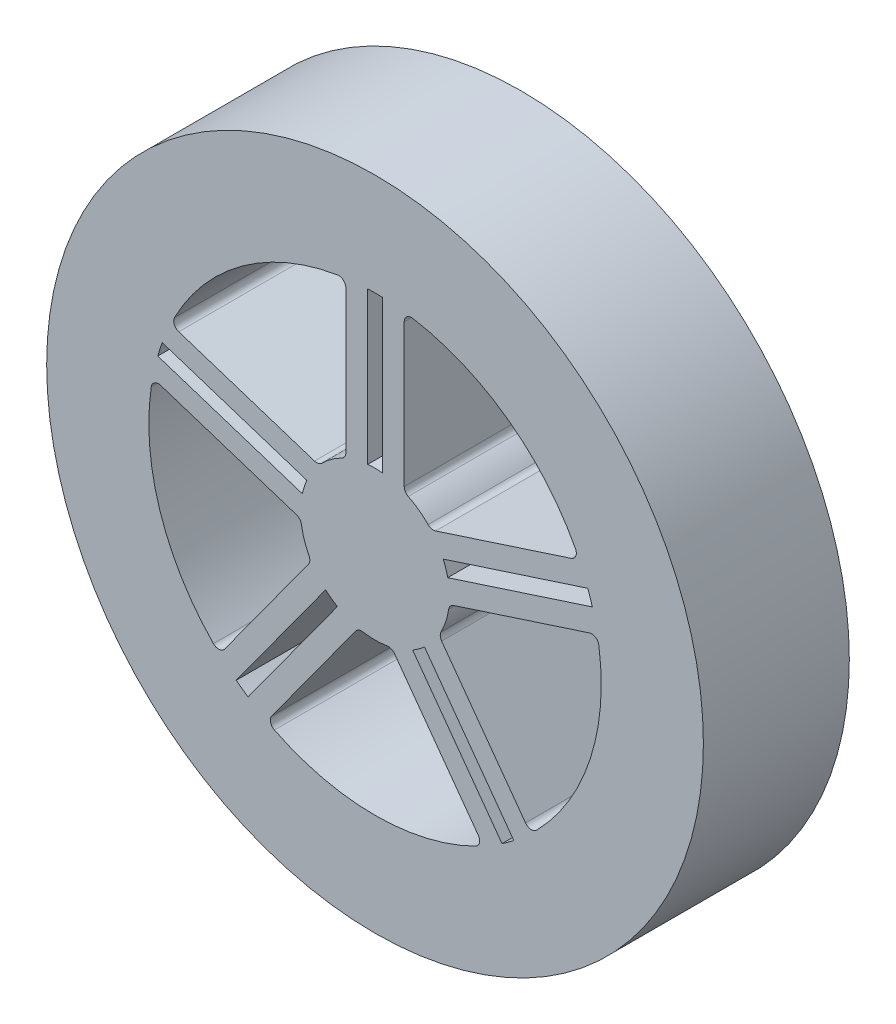
from build123d import *

# Parameters (mm, degrees)
ESQUISSE1_R                  = 5.1
ESQUISSE1_R_2                = 2.1
BOSS_EXTRU_1_DEPTH           = 10
ESQUISSE2_R                  = 22.5
BOSS_EXTRU_3_DEPTH           = 10
CONG_5_R                     = 0.5
R_P_TITION_CIRCULAIRE2_COUNT = 5
CONG_6_R                     = 0.5


with BuildPart() as part:
    # Esquisse1 → Boss.-Extru.1 (new body)
    with BuildSketch(Plane.XY):
        Circle(ESQUISSE1_R)
        Circle(ESQUISSE1_R_2, mode=Mode.SUBTRACT)
    extrude(amount=BOSS_EXTRU_1_DEPTH)


with BuildPart() as body_2:
    # Esquisse2 → Boss.-Extru.3 (new body)
    with BuildSketch(Plane.XY.offset(10)):
        Circle(ESQUISSE2_R)
        with BuildLine():
            Line((2, 4.691481642), (2, 15.370426149))
            ThreePointArc((2, 15.370426149), (0, -15.5), (-2, 15.370426149))
            Line((-2, 15.370426149), (-2, 4.691481642))
            ThreePointArc((-2, 4.691481642), (0, -5.1), (2, 4.691481642))
        make_face(mode=Mode.SUBTRACT)
        with BuildLine():
            Line((-0.5, 5.075431016), (-0.5, 15.491933385))
            ThreePointArc((-0.5, 15.491933385), (0, 15.5), (0.5, 15.491933385))
            Line((0.5, 15.491933385), (0.5, 5.075431016))
            ThreePointArc((0.5, 5.075431016), (0, 5.1), (-0.5, 5.075431016))
        make_face(mode=Mode.SUBTRACT)
    boss_extru_3 = extrude(amount=BOSS_EXTRU_3_DEPTH)

    # Congé5
    cong_5_edges = [body_2.edges().sort_by_distance(p)[0] for p in [
        (2, 4.691481642, 15),
        (-2, 4.691481642, 15),
        (-2, 15.370426149, 15),
        (2, 15.370426149, 15),
    ]]
    fillet(cong_5_edges, radius=CONG_5_R)

    # Répétition circulaire2: Boss.-Extru.3 ×5 about axis
    r_p_tition_circulaire2_axis = Axis((0, 0, 0), (0, 0, 1))
    for i in range(1, R_P_TITION_CIRCULAIRE2_COUNT):
        add(boss_extru_3.rotate(r_p_tition_circulaire2_axis, i * 360 / R_P_TITION_CIRCULAIRE2_COUNT))

    # Congé6
    cong_6_edges = [body_2.edges().sort_by_distance(p)[0] for p in [
        (-14.000109958, 6.651835923, 15),
        (-10.652543801, -11.259365461, 15),
        (7.416475823, -13.61050647, 15),
        (15.236177936, 2.847609858, 15),
        (-5.079898176, -0.452365476, 15),
        (-1.139549732, -4.971058882, 15),
        (3.843830198, 3.351860589, 15),
        (4.375617709, -2.619917873, 15),
        (-3.843830198, 3.351860589, 15),
        (-15.236177936, 2.847609858, 15),
        (1.139549732, -4.971058882, 15),
        (10.652543801, -11.259365461, 15),
        (5.079898176, -0.452365476, 15),
        (14.000109958, 6.651835923, 15),
        (-7.416475823, -13.61050647, 15),
        (-4.375617709, -2.619917873, 15),
    ]]
    fillet(cong_6_edges, radius=CONG_6_R)


solid = Compound([part.part, body_2.part])
